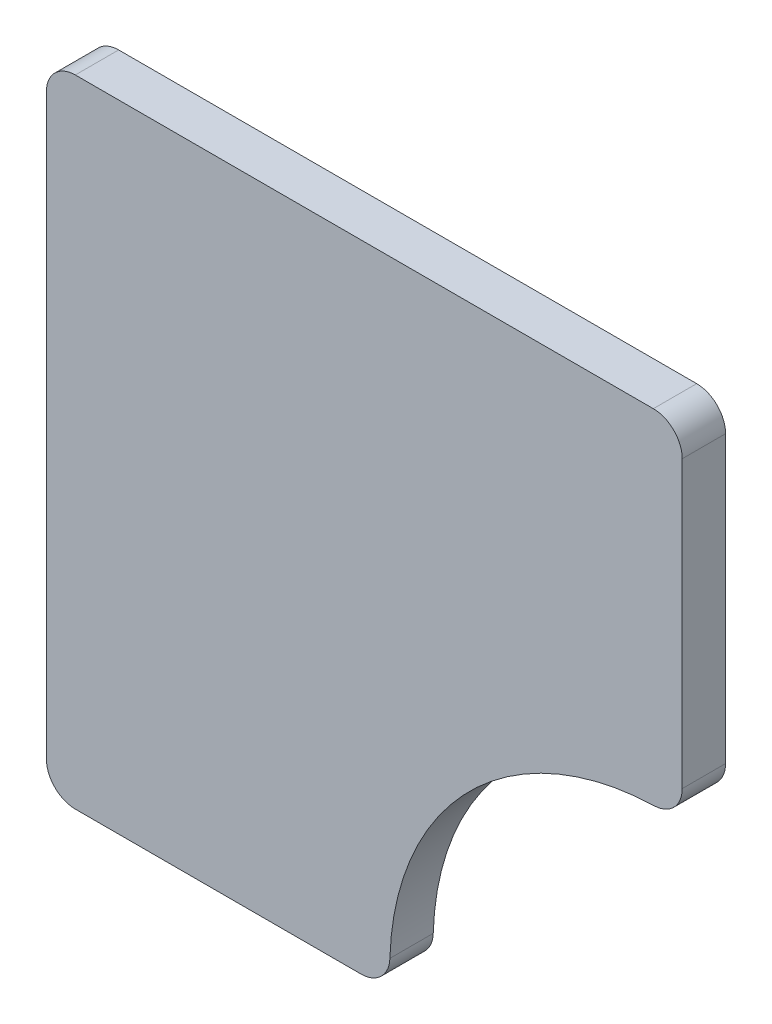
from build123d import *

# Parameters (mm, degrees)
BOSS_EXTRUDE1_DEPTH = 3


with BuildPart() as part:
    # Sketch1 → Boss-Extrude1 (new body)
    with BuildSketch(Plane.XY):
        with BuildLine():
            Line((-307.184555639, 613.714480845), (-347.184555639, 613.714480845))
            ThreePointArc((-347.184555639, 613.714480845), (-348.598769202, 613.128694407), (-349.184555639, 611.714480845))
            Line((-349.184555639, 611.714480845), (-349.184555639, 571.714480845))
            ThreePointArc((-349.184555639, 571.714480845), (-348.598769202, 570.300267282), (-347.184555639, 569.714480845))
            Line((-347.184555639, 569.714480845), (-327.414726928, 569.714480845))
            ThreePointArc((-327.414726928, 569.714480845), (-326.021875182, 570.279223372), (-325.415626051, 571.65451683))
            ThreePointArc((-325.415626051, 571.65451683), (-319.898638459, 584.428563664), (-307.124591625, 589.945551256))
            ThreePointArc((-307.124591625, 589.945551256), (-305.749298166, 590.551800388), (-305.184555639, 591.944652133))
            Line((-305.184555639, 591.944652133), (-305.184555639, 611.714480845))
            ThreePointArc((-305.184555639, 611.714480845), (-305.770342077, 613.128694407), (-307.184555639, 613.714480845))
        make_face()
    extrude(amount=BOSS_EXTRUDE1_DEPTH)


solid = part.part
